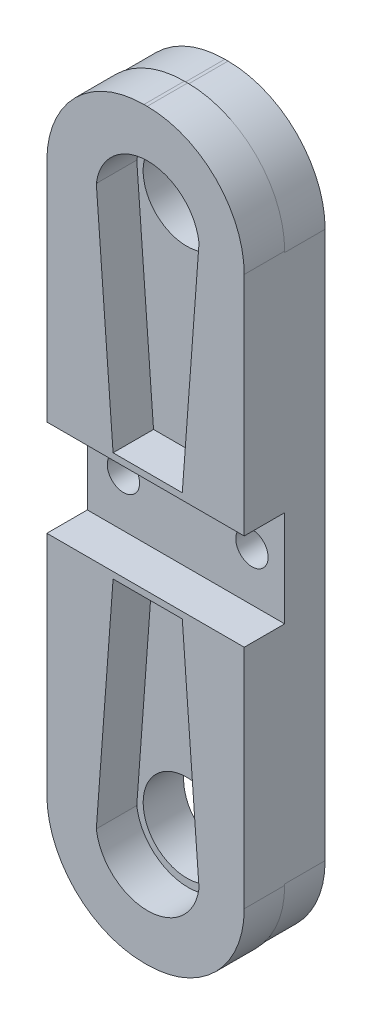
from build123d import *

# Parameters (mm, degrees)
SKETCH1_W           = 12.2
SKETCH1_H           = 45.8
BOSS_EXTRUDE1_DEPTH = 2.5
FILLET1_R           = 6
SKETCH2_W           = 12.2
SKETCH2_H           = 20
BOSS_EXTRUDE2_DEPTH = 2.5
FILLET2_R           = 6
SKETCH3_R           = 1
CUT_EXTRUDE1_DEPTH  = 2.5
CUT_EXTRUDE2_DEPTH  = 2.5
SKETCH5_R           = 2.7
CUT_EXTRUDE3_DEPTH  = 2.5


with BuildPart() as part:
    # Sketch1 → Boss-Extrude1 (new body)
    with BuildSketch(Plane.XY.offset(10)):
        with Locations((-182.131179691, 159.988166791)):
            Rectangle(SKETCH1_W, SKETCH1_H)
    extrude(amount=BOSS_EXTRUDE1_DEPTH)

    # Fillet1
    fillet1_edges = [part.edges().sort_by_distance(p)[0] for p in [
        (-188.231179691, 182.888166791, 11.25),
        (-176.031179691, 182.888166791, 11.25),
        (-176.031179691, 137.088166791, 11.25),
        (-188.231179691, 137.088166791, 11.25),
    ]]
    fillet(fillet1_edges, radius=FILLET1_R)

    # Sketch2 → Boss-Extrude2 (add)
    with BuildSketch(Plane.XY.offset(12.5)):
        with Locations((-182.131179691, 172.965455297)):
            Rectangle(SKETCH2_W, SKETCH2_H)
        with Locations((-182.131179691, 147.010878284)):
            Rectangle(SKETCH2_W, SKETCH2_H)
    extrude(amount=BOSS_EXTRUDE2_DEPTH)

    # Fillet2
    fillet2_edges = [part.edges().sort_by_distance(p)[0] for p in [
        (-176.031179691, 182.965455297, 13.75),
        (-188.231179691, 182.965455297, 13.75),
        (-176.031179691, 137.010878284, 13.75),
        (-188.231179691, 137.010878284, 13.75),
    ]]
    fillet(fillet2_edges, radius=FILLET2_R)

    # Sketch3 → Cut-Extrude1 (cut)
    with BuildSketch(Plane.XY.offset(12.5)):
        with Locations((-185.999682024, 160.057912714)):
            Circle(SKETCH3_R)
        with Locations((-178.054871456, 160.057912714)):
            Circle(SKETCH3_R)
    extrude(amount=-CUT_EXTRUDE1_DEPTH, mode=Mode.SUBTRACT)

    # Sketch4 → Cut-Extrude2 (cut)
    with BuildSketch(Plane.XY.offset(15)):
        with BuildLine():
            Line((-184.138427734, 163.365707397), (-179.861572266, 163.365707397))
            Line((-179.861572266, 163.365707397), (-178.824890137, 177.264755249))
            ThreePointArc((-178.824890137, 177.264755249), (-182, 180.059517658), (-185.175109863, 177.264755249))
            Line((-185.175109863, 177.264755249), (-184.138427734, 163.365707397))
        make_face()
        with BuildLine():
            Line((-184.138427734, 156.610626184), (-185.175109863, 142.711578332))
            ThreePointArc((-185.175109863, 142.711578332), (-182, 139.916815923), (-178.824890137, 142.711578332))
            Line((-178.824890137, 142.711578332), (-179.861572266, 156.610626184))
            Line((-179.861572266, 156.610626184), (-184.138427734, 156.610626184))
        make_face()
    extrude(amount=-CUT_EXTRUDE2_DEPTH, mode=Mode.SUBTRACT)

    # Sketch5 → Cut-Extrude3 (cut)
    with BuildSketch(Plane.XY.offset(12.5)):
        with Locations((-182.080577922, 176.90016829)):
            Circle(SKETCH5_R)
        with Locations(Location((-182.080577922, 143.076165291, 0), (0, 0, 180))):
            Circle(SKETCH5_R)
    extrude(amount=-CUT_EXTRUDE3_DEPTH, mode=Mode.SUBTRACT)


solid = part.part
